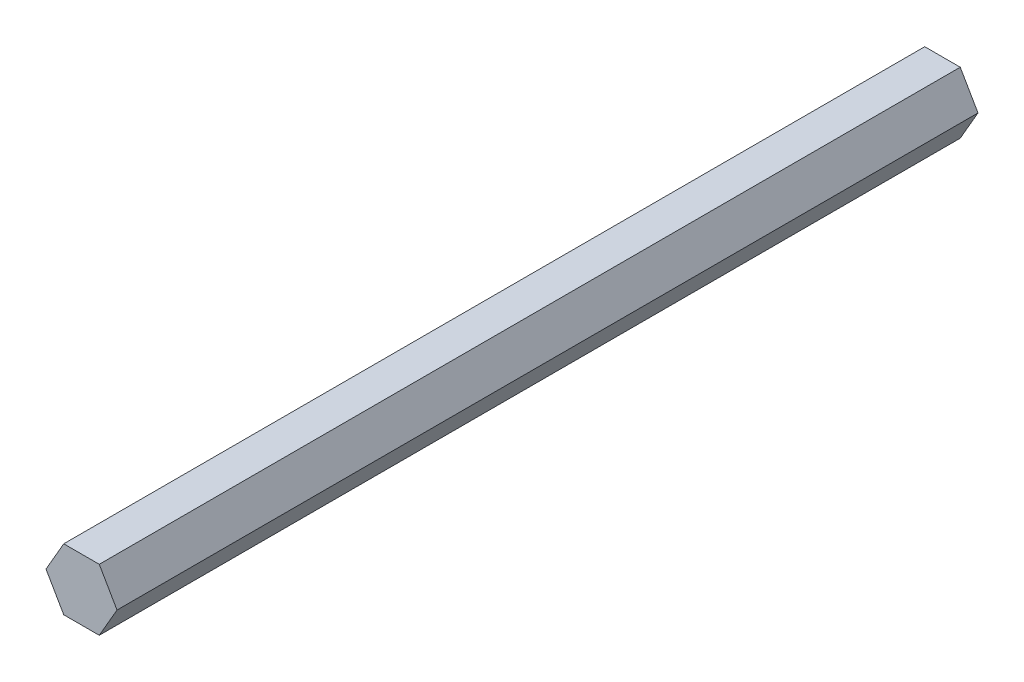
from build123d import *

# Parameters (mm, degrees)
BOSS_EXTRUDE1_DEPTH = 177.8


with BuildPart() as part:
    # Sketch1 → Boss-Extrude1 (new body)
    with BuildSketch(Plane.XY):
        Polygon((0, 12.7), (7.332348419, 12.7), (10.998522628, 6.35), (7.332348419, 0), (0, 0), (-3.666174209, 6.35), align=None)
    extrude(amount=BOSS_EXTRUDE1_DEPTH)


solid = part.part
